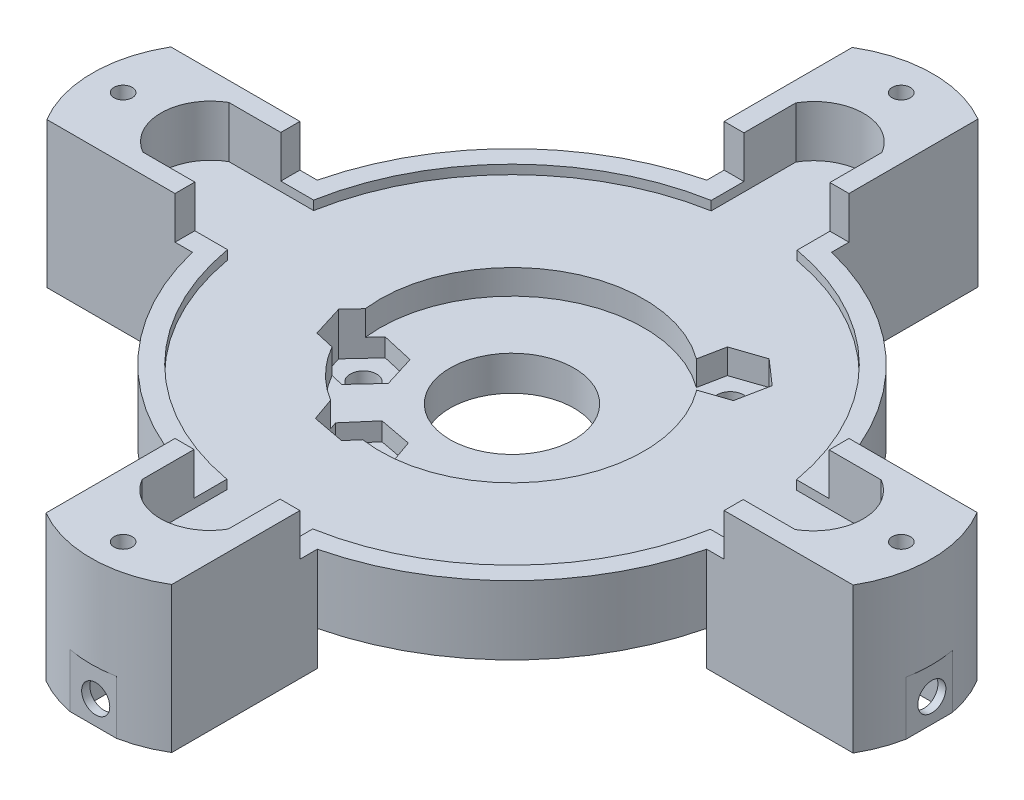
from build123d import *

# Parameters (mm, degrees)
SKETCH1_R                = 32
BOSS_EXTRUDE1_DEPTH      = 8.3
BOSS_EXTRUDE2_DEPTH      = 5.1
BOSS_EXTRUDE2_DEPTH_BACK = 12.5
CUT_EXTRUDE1_START       = -1.1
CUT_EXTRUDE1_DEPTH       = 6.2
SKETCH3_R                = 15.95
CUT_EXTRUDE2_DEPTH       = 3
CUT_EXTRUDE3_REACH       = 74.456
SKETCH4_R                = 7.5
CUT_EXTRUDE4_DEPTH       = 3
CUT_EXTRUDE5_REACH       = 75.108
SKETCH5_3_R              = 1.6
CUT_EXTRUDE6_DEPTH       = 3
CUT_EXTRUDE7_START       = -2.2
CUT_EXTRUDE7_DEPTH       = 5.2
SKETCH10_W               = 66.4
SKETCH10_H               = 66.4
CUT_EXTRUDE8_DEPTH       = 5.1
CUT_EXTRUDE9_REACH       = 75.993
SKETCH11_R               = 1.1
SKETCH12_W               = 4.8
SKETCH12_H               = 5.3
SKETCH12_W_2             = 5.35
SKETCH12_H_2             = 4.8
SKETCH12_H_3             = 5.35
CUT_EXTRUDE10_DEPTH      = 12.6
SKETCH13_W               = 6.3
SKETCH13_H               = 2.5
SKETCH13_W_2             = 2.5
SKETCH13_H_2             = 6.3
CUT_EXTRUDE11_DEPTH      = 6.5
SKETCH14_R               = 1.7
CUT_EXTRUDE12_DEPTH      = 3.5
SKETCH15_W               = 6.299640284
SKETCH15_H               = 2.5
CUT_EXTRUDE13_DEPTH      = 7.6
CIRPATTERN1_COUNT        = 4
CUT_EXTRUDE14_DEPTH      = 6.5
SKETCH17_R               = 1.7
CUT_EXTRUDE15_DEPTH      = 9
CIRPATTERN9_COUNT        = 4


with BuildPart() as part:
    # Sketch1 → Boss-Extrude1 (new body)
    with BuildSketch(Plane(origin=(0, 0, 0), x_dir=(1, 0, 0), z_dir=(0, 1, 0))):
        with Locations(Location((0, 0, 0), (0, 0, 90))):
            Circle(SKETCH1_R)
    extrude(amount=BOSS_EXTRUDE1_DEPTH)

    # Sketch6 → Boss-Extrude2 (add, two sides: drawn at the far end of the back side and taken through both)
    with BuildSketch(Plane(origin=(0, 8.3, 0), x_dir=(1, 0, 0), z_dir=(0, 1, 0)).offset(-BOSS_EXTRUDE2_DEPTH_BACK)):
        with BuildLine():
            Line((-7.549820142, 48.696627081), (-7.549820142, 31.096627081))
            Line((-7.549820142, 31.096627081), (7.549820142, 31.096627081))
            Line((7.549820142, 31.096627081), (7.549820142, 48.800854298))
            ThreePointArc((7.549820142, 48.800854298), (-0.014292277, 50.819296248), (-7.549820142, 48.696627081))
        make_face()
        with BuildLine():
            Line((31.096627081, 7.549820142), (31.096627081, -7.549820142))
            Line((31.096627081, -7.549820142), (48.800854298, -7.549820142))
            ThreePointArc((48.800854298, -7.549820142), (50.819296248, 0.014292277), (48.696627081, 7.549820142))
            Line((48.696627081, 7.549820142), (31.096627081, 7.549820142))
        make_face()
        with BuildLine():
            Line((7.549820142, -31.096627081), (-7.549820142, -31.096627081))
            Line((-7.549820142, -31.096627081), (-7.549820142, -48.800854298))
            ThreePointArc((-7.549820142, -48.800854298), (0.014292277, -50.819296248), (7.549820142, -48.696627081))
            Line((7.549820142, -48.696627081), (7.549820142, -31.096627081))
        make_face()
        with BuildLine():
            Line((-31.096627081, -7.549820142), (-31.096627081, 7.549820142))
            Line((-31.096627081, 7.549820142), (-48.800854298, 7.549820142))
            ThreePointArc((-48.800854298, 7.549820142), (-50.819296248, -0.014292277), (-48.696627081, -7.549820142))
            Line((-48.696627081, -7.549820142), (-31.096627081, -7.549820142))
        make_face()
    extrude(amount=BOSS_EXTRUDE2_DEPTH + BOSS_EXTRUDE2_DEPTH_BACK)

    # Sketch2 → Cut-Extrude1 (cut)
    with BuildSketch(Plane(origin=(0, 8.3, 0), x_dir=(1, 0, 0), z_dir=(0, 1, 0)).offset(CUT_EXTRUDE1_START)):
        with BuildLine():
            Line((29.233353695, -5.244142615), (39.479328292, -5.244142615))
            ThreePointArc((39.479328292, -5.244142615), (42.486002382, -0.044142615), (39.479328292, 5.155857385))
            Line((39.479328292, 5.155857385), (29.249053568, 5.155857385))
            ThreePointArc((29.249053568, 5.155857385), (21.03275072, 20.969344223), (5.244142615, 29.233353695))
            Line((5.244142615, 29.233353695), (5.244142615, 39.479328292))
            ThreePointArc((5.244142615, 39.479328292), (0.044142615, 42.486002382), (-5.155857385, 39.479328292))
            Line((-5.155857385, 39.479328292), (-5.155857385, 29.249053568))
            ThreePointArc((-5.155857385, 29.249053568), (-20.969344223, 21.03275072), (-29.233353695, 5.244142615))
            Line((-29.233353695, 5.244142615), (-39.479328292, 5.244142615))
            ThreePointArc((-39.479328292, 5.244142615), (-42.486002382, 0.044142615), (-39.479328292, -5.155857385))
            Line((-39.479328292, -5.155857385), (-29.249053568, -5.155857385))
            ThreePointArc((-29.249053568, -5.155857385), (-21.03275072, -20.969344223), (-5.244142615, -29.233353695))
            Line((-5.244142615, -29.233353695), (-5.244142615, -39.479328292))
            ThreePointArc((-5.244142615, -39.479328292), (-0.044142615, -42.486002382), (5.155857385, -39.479328292))
            Line((5.155857385, -39.479328292), (5.155857385, -29.249053568))
            ThreePointArc((5.155857385, -29.249053568), (20.969344223, -21.03275072), (29.233353695, -5.244142615))
        make_face()
    extrude(amount=CUT_EXTRUDE1_DEPTH, mode=Mode.SUBTRACT)

    # Sketch3 → Cut-Extrude2 (cut)
    with BuildSketch(Plane(origin=(0, 7.2, 0), x_dir=(1, 0, 0), z_dir=(0, 1, 0))):
        with Locations(Location((0, 0, 0), (0, 0, 270))):
            Circle(SKETCH3_R)
    extrude(amount=-CUT_EXTRUDE2_DEPTH, mode=Mode.SUBTRACT)

    # Sketch4 → Cut-Extrude3 (cut, up to next)
    with BuildSketch(Plane(origin=(0, 4.2, 0), x_dir=(1, 0, 0), z_dir=(0, 1, 0)), mode=Mode.PRIVATE) as cut_extrude3_sk1:
        with Locations(Location((0, 0, 0), (0, 0, 270))):
            Circle(SKETCH4_R)
    cut_extrude3_tool1 = extrude(cut_extrude3_sk1.sketch, amount=-CUT_EXTRUDE3_REACH, mode=Mode.PRIVATE) & part.part
    add(cut_extrude3_tool1.solids().sort_by_distance((0, 4.2, 0))[0], mode=Mode.SUBTRACT)

    # Sketch5 → Cut-Extrude4 (cut)
    # profile 1 of 5: a face of its own
    with BuildSketch(Plane.XZ):
        with BuildLine():
            Line((31.096627081, -6.155467827), (31.096627081, 6.155467827))
            ThreePointArc((31.096627081, 6.155467827), (22.415284964, 22.415284964), (6.155467827, 31.096627081))
            Line((6.155467827, 31.096627081), (-6.155467827, 31.096627081))
            ThreePointArc((-6.155467827, 31.096627081), (-22.415284964, 22.415284964), (-31.096627081, 6.155467827))
            Line((-31.096627081, 6.155467827), (-31.096627081, -6.155467827))
            ThreePointArc((-31.096627081, -6.155467827), (-22.415284964, -22.415284964), (-6.155467827, -31.096627081))
            Line((-6.155467827, -31.096627081), (6.155467827, -31.096627081))
            ThreePointArc((6.155467827, -31.096627081), (22.415284964, -22.415284964), (31.096627081, -6.155467827))
        make_face()
        with BuildLine():
            Line((-19.75, 4.693346354), (-19.75, 19.75))
            Line((-19.75, 19.75), (-4.693346354, 19.75))
            ThreePointArc((-4.693346354, 19.75), (0, 20.3), (4.693346354, 19.75))
            Line((4.693346354, 19.75), (19.75, 19.75))
            Line((19.75, 19.75), (19.75, 4.693346354))
            ThreePointArc((19.75, 4.693346354), (20.162031148, 2.36273147), (20.3, 0))
            ThreePointArc((20.3, 0), (20.162031148, -2.36273147), (19.75, -4.693346354))
            Line((19.75, -4.693346354), (19.75, -19.75))
            Line((19.75, -19.75), (4.693346354, -19.75))
            ThreePointArc((4.693346354, -19.75), (0, -20.3), (-4.693346354, -19.75))
            Line((-4.693346354, -19.75), (-19.75, -19.75))
            Line((-19.75, -19.75), (-19.75, -4.693346354))
            ThreePointArc((-19.75, -4.693346354), (-20.3, 0), (-19.75, 4.693346354))
        make_face(mode=Mode.SUBTRACT)
    # profile 2 of 5: a face of its own
    with BuildSketch(Plane.XZ):
        with BuildLine():
            ThreePointArc((-4.693346354, -19.75), (-14.354267658, -14.354267658), (-19.75, -4.693346354))
            Line((-19.75, -4.693346354), (-19.75, -19.75))
            Line((-19.75, -19.75), (-4.693346354, -19.75))
        make_face()
    # profile 3 of 5: a face of its own
    with BuildSketch(Plane.XZ):
        with BuildLine():
            Line((19.75, -19.75), (19.75, -4.693346354))
            ThreePointArc((19.75, -4.693346354), (18.844037206, -7.549321942), (17.527557771, -10.240835835))
            ThreePointArc((17.527557771, -10.240835835), (17.744168367, -11.15000424), (17.816960645, -12.081781372))
            ThreePointArc((17.816960645, -12.081781372), (15.295306964, -16.970657203), (9.849925016, -17.750182455))
            ThreePointArc((9.849925016, -17.750182455), (7.340061518, -18.926528919), (4.693346354, -19.75))
            Line((4.693346354, -19.75), (19.75, -19.75))
        make_face()
    # profile 4 of 5: a face of its own
    with BuildSketch(Plane.XZ):
        with BuildLine():
            Line((19.75, 19.75), (4.693346354, 19.75))
            ThreePointArc((4.693346354, 19.75), (14.354267658, 14.354267658), (19.75, 4.693346354))
            Line((19.75, 4.693346354), (19.75, 19.75))
        make_face()
    # profile 5 of 5: a face of its own
    with BuildSketch(Plane.XZ):
        with BuildLine():
            Line((-4.693346354, 19.75), (-19.75, 19.75))
            Line((-19.75, 19.75), (-19.75, 4.693346354))
            ThreePointArc((-19.75, 4.693346354), (-14.354267658, 14.354267658), (-4.693346354, 19.75))
        make_face()
    extrude(amount=-CUT_EXTRUDE4_DEPTH, mode=Mode.SUBTRACT)

    # Sketch5<3> → Cut-Extrude5 (cut, up to next)
    with BuildSketch(Plane.XZ, mode=Mode.PRIVATE) as cut_extrude5_sk1:
        with Locations(Location((13.057381172, -13.35, 0), (0, 0, 270))):
            Circle(SKETCH5_3_R)
    cut_extrude5_tool1 = extrude(cut_extrude5_sk1.sketch, amount=-CUT_EXTRUDE5_REACH, mode=Mode.PRIVATE) & part.part
    # Sketch5<3> → Cut-Extrude5 (cut, up to next)
    with BuildSketch(Plane.XZ, mode=Mode.PRIVATE) as cut_extrude5_sk2:
        with Locations(Location((-4.760987924, 13.397183211, 0), (0, 0, 270))):
            Circle(SKETCH5_3_R)
    cut_extrude5_tool2 = extrude(cut_extrude5_sk2.sketch, amount=-CUT_EXTRUDE5_REACH, mode=Mode.PRIVATE) & part.part
    # Sketch5<3> → Cut-Extrude5 (cut, up to next)
    with BuildSketch(Plane.XZ, mode=Mode.PRIVATE) as cut_extrude5_sk3:
        with Locations(Location((-13.500367551, 4.46, 0), (0, 0, 270))):
            Circle(SKETCH5_3_R)
    cut_extrude5_tool3 = extrude(cut_extrude5_sk3.sketch, amount=-CUT_EXTRUDE5_REACH, mode=Mode.PRIVATE) & part.part
    add(cut_extrude5_tool1.solids().sort_by_distance((13.057381, 0, -13.35))[0], mode=Mode.SUBTRACT)
    add(cut_extrude5_tool2.solids().sort_by_distance((-4.760988, 0, 13.397183))[0], mode=Mode.SUBTRACT)
    add(cut_extrude5_tool3.solids().sort_by_distance((-13.500368, 0, 4.46))[0], mode=Mode.SUBTRACT)

    # Sketch7 → Cut-Extrude6 (cut)
    with BuildSketch(Plane(origin=(0, 7.2, 0), x_dir=(1, 0, 0), z_dir=(0, 1, 0))):
        Polygon((10.065501794, 15.980334158), (9.283505282, 12.074123532), (12.27538466, 9.443789374), (16.049260551, 10.719665842), (16.831257063, 14.625876468), (13.839377684, 17.256210626), align=None)
    extrude(amount=-CUT_EXTRUDE6_DEPTH, mode=Mode.SUBTRACT)

    # Sketch9 → Cut-Extrude7 (cut)
    with BuildSketch(Plane(origin=(0, 4.2, 0), x_dir=(1, 0, 0), z_dir=(0, 1, 0)).offset(CUT_EXTRUDE7_START)):
        Polygon((-6.07779475, -9.637393352), (-8.675464868, -12.657676444), (-7.358658042, -16.417466303), (-3.444181098, -17.15697307), (-0.846510981, -14.136689978), (-2.163317806, -10.376900119), align=None)
        Polygon((-10.793862159, -1.536846127), (-14.678640368, -0.654520639), (-17.38514576, -3.577674512), (-16.206872942, -7.383153873), (-12.322094733, -8.265479361), (-9.615589341, -5.342325488), align=None)
    extrude(amount=CUT_EXTRUDE7_DEPTH, mode=Mode.SUBTRACT)

    # Sketch10 → Cut-Extrude8 (cut)
    with BuildSketch(Plane(origin=(0, 8.3, 0), x_dir=(1, 0, 0), z_dir=(0, 1, 0))):
        Rectangle(SKETCH10_W, SKETCH10_H)
    extrude(amount=CUT_EXTRUDE8_DEPTH, mode=Mode.SUBTRACT)

    # Sketch11 → Cut-Extrude9 (cut, up to next)
    with BuildSketch(Plane(origin=(0, 13.4, 0), x_dir=(1, 0, 0), z_dir=(0, 1, 0)), mode=Mode.PRIVATE) as cut_extrude9_sk1:
        with Locations(Location((0.1405, -47.1674, 0), (0, 0, 270))):
            Circle(SKETCH11_R)
    cut_extrude9_tool1 = extrude(cut_extrude9_sk1.sketch, amount=-CUT_EXTRUDE9_REACH, mode=Mode.PRIVATE) & part.part
    # Sketch11 → Cut-Extrude9 (cut, up to next)
    with BuildSketch(Plane(origin=(0, 13.4, 0), x_dir=(1, 0, 0), z_dir=(0, 1, 0)), mode=Mode.PRIVATE) as cut_extrude9_sk2:
        with Locations(Location((-46.9095, -0.1174, 0), (0, 0, 270))):
            Circle(SKETCH11_R)
    cut_extrude9_tool2 = extrude(cut_extrude9_sk2.sketch, amount=-CUT_EXTRUDE9_REACH, mode=Mode.PRIVATE) & part.part
    # Sketch11 → Cut-Extrude9 (cut, up to next)
    with BuildSketch(Plane(origin=(0, 13.4, 0), x_dir=(1, 0, 0), z_dir=(0, 1, 0)), mode=Mode.PRIVATE) as cut_extrude9_sk3:
        with Locations(Location((0.1405, 46.92716992, 0), (0, 0, 270))):
            Circle(SKETCH11_R)
    cut_extrude9_tool3 = extrude(cut_extrude9_sk3.sketch, amount=-CUT_EXTRUDE9_REACH, mode=Mode.PRIVATE) & part.part
    # Sketch11 → Cut-Extrude9 (cut, up to next)
    with BuildSketch(Plane(origin=(0, 13.4, 0), x_dir=(1, 0, 0), z_dir=(0, 1, 0)), mode=Mode.PRIVATE) as cut_extrude9_sk4:
        with Locations(Location((47.195095373, -0.1174, 0), (0, 0, 270))):
            Circle(SKETCH11_R)
    cut_extrude9_tool4 = extrude(cut_extrude9_sk4.sketch, amount=-CUT_EXTRUDE9_REACH, mode=Mode.PRIVATE) & part.part
    add(cut_extrude9_tool1.solids().sort_by_distance((0.1405, 13.4, 47.1674))[0], mode=Mode.SUBTRACT)
    add(cut_extrude9_tool2.solids().sort_by_distance((-46.9095, 13.4, 0.1174))[0], mode=Mode.SUBTRACT)
    add(cut_extrude9_tool3.solids().sort_by_distance((0.1405, 13.4, -46.92717))[0], mode=Mode.SUBTRACT)
    add(cut_extrude9_tool4.solids().sort_by_distance((47.195095, 13.4, 0.1174))[0], mode=Mode.SUBTRACT)

    # Sketch12 → Cut-Extrude10 (cut)
    with BuildSketch(Plane.XZ.offset(4.2)):
        with Locations((-46.9095, 0.1174)):
            Rectangle(SKETCH12_W, SKETCH12_H)
        with Locations((0.1405, -46.92716992)):
            Rectangle(SKETCH12_W_2, SKETCH12_H_2)
        with Locations((0.1405, 47.1674)):
            Rectangle(SKETCH12_W_2, SKETCH12_H_2)
        with Locations((47.195095373, 0.1174)):
            Rectangle(SKETCH12_W, SKETCH12_H_3)
    extrude(amount=-CUT_EXTRUDE10_DEPTH, mode=Mode.SUBTRACT)

    # Sketch13 → Cut-Extrude11 (cut)
    with BuildSketch(Plane.XZ.offset(4.2)):
        with Locations((0.1405, 40.846627081)):
            Rectangle(SKETCH13_W, SKETCH13_H)
        with Locations((40.537781667, -0.3)):
            Rectangle(SKETCH13_W_2, SKETCH13_H_2)
        with Locations((-0.608845414, -40.697281667)):
            Rectangle(SKETCH13_W, SKETCH13_H)
        with Locations((-41.006127081, 0.449345414)):
            Rectangle(SKETCH13_W_2, SKETCH13_H_2)
    extrude(amount=-CUT_EXTRUDE11_DEPTH, mode=Mode.SUBTRACT)

    # Sketch14 → Cut-Extrude12 (cut)
    with BuildSketch(Plane.XZ.offset(4.2)):
        with Locations(Location((0.35, 35.196627081, 0), (0, 0, 270))):
            Circle(SKETCH14_R)
        with Locations(Location((34.887781667, -0.35, 0), (0, 0, 270))):
            Circle(SKETCH14_R)
        with Locations(Location((-0.658845414, -34.887781667, 0), (0, 0, 270))):
            Circle(SKETCH14_R)
        with Locations(Location((-35.196627081, 0.658845414, 0), (0, 0, 270))):
            Circle(SKETCH14_R)
    extrude(amount=-CUT_EXTRUDE12_DEPTH, mode=Mode.SUBTRACT)

    # Sketch15 → Cut-Extrude13 (cut)
    with BuildSketch(Plane(origin=(-31.096627081, 0, 0), x_dir=(0, 0, -1), z_dir=(1, 0, 0))):
        with Locations((-0.3, 0.55)):
            Rectangle(SKETCH15_W, SKETCH15_H)
    cut_extrude13 = extrude(amount=-CUT_EXTRUDE13_DEPTH, mode=Mode.SUBTRACT)

    # CirPattern1: Cut-Extrude13 ×4 about axis
    cirpattern1_axis = Axis((0, 0, 0), (0, 1, 0))
    for i in range(1, CIRPATTERN1_COUNT):
        add(cut_extrude13.rotate(cirpattern1_axis, i * 360 / CIRPATTERN1_COUNT), mode=Mode.SUBTRACT)

    # Sketch16 → Cut-Extrude14 (cut)
    with BuildSketch(Plane.XZ.offset(4.2)):
        with BuildLine():
            Line((50.552370518, 2.8878642), (50.552370518, -2.7121358))
            ThreePointArc((50.552370518, -2.7121358), (50.819648818, 0.0878642), (50.552370518, 2.8878642))
        make_face()
        with BuildLine():
            Line((2.8878642, -50.552370518), (-2.7121358, -50.552370518))
            ThreePointArc((-2.7121358, -50.552370518), (0.0878642, -50.819648818), (2.8878642, -50.552370518))
        make_face()
        with BuildLine():
            Line((-50.552370518, -2.8878642), (-50.552370518, 2.7121358))
            ThreePointArc((-50.552370518, 2.7121358), (-50.819648818, -0.0878642), (-50.552370518, -2.8878642))
        make_face()
        with BuildLine():
            Line((-2.8878642, 50.552370518), (2.7121358, 50.552370518))
            ThreePointArc((2.7121358, 50.552370518), (-0.0878642, 50.819648818), (-2.8878642, 50.552370518))
        make_face()
    extrude(amount=-CUT_EXTRUDE14_DEPTH, mode=Mode.SUBTRACT)

    # Sketch17 → Cut-Extrude15 (cut)
    with BuildSketch(Plane(origin=(50.552370518, 0, 0), x_dir=(0, 0, -1), z_dir=(1, 0, 0))):
        with Locations((0.2121358, -1.3)):
            Circle(SKETCH17_R)
    cut_extrude15 = extrude(amount=-CUT_EXTRUDE15_DEPTH, mode=Mode.SUBTRACT)

    # CirPattern9: Cut-Extrude15 ×4 about axis
    cirpattern9_axis = Axis((0, 0, 0), (0, 1, 0))
    for i in range(1, CIRPATTERN9_COUNT):
        add(cut_extrude15.rotate(cirpattern9_axis, i * 360 / CIRPATTERN9_COUNT), mode=Mode.SUBTRACT)


solid = part.part
